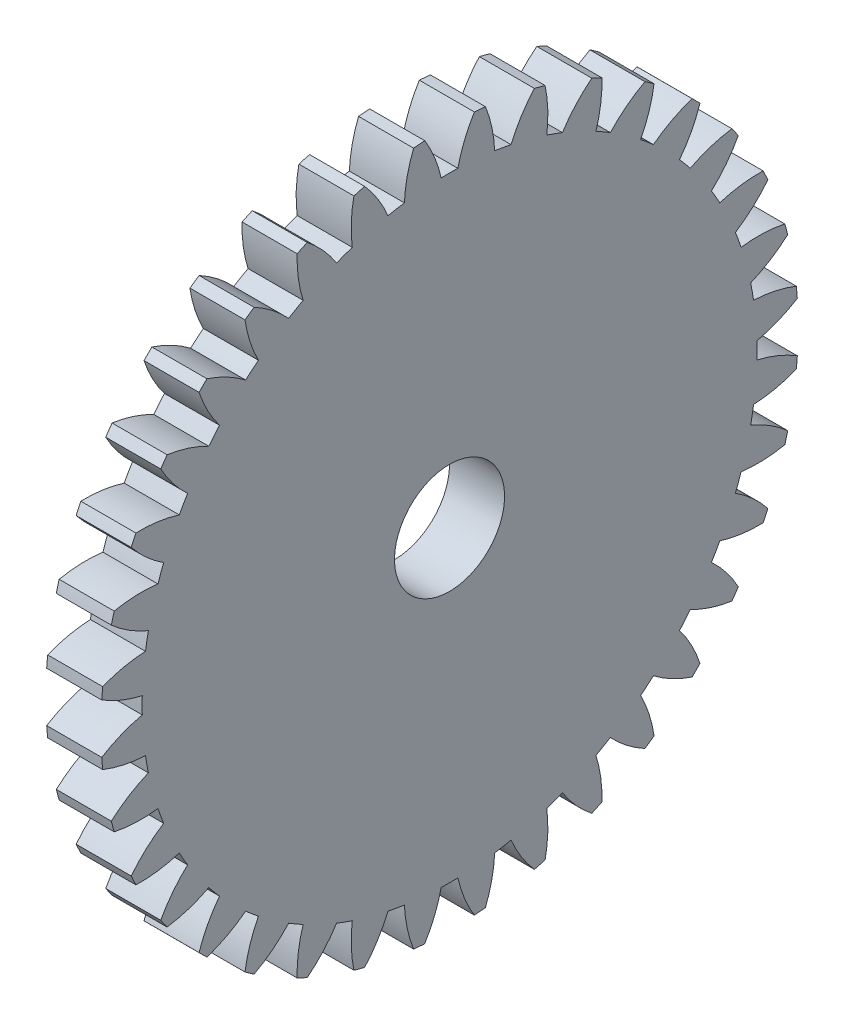
from build123d import *

# Parameters (mm, degrees)
BASPROSKE_W     = 3
BASPROSKE_H     = 19
TOOTHCUT_DEPTH  = 28.037011669
TEETHCUTS_COUNT = 36
TEETHCUTS_ANGLE = 350
BORSKE_R        = 3
BORE_DEPTH      = 50.0000508


with BuildPart() as part:
    # BasProSke → Base-Revolve (revolve)
    with BuildSketch(Plane(origin=(0, 0, 0), x_dir=(1, 0, 0), z_dir=(0, 1, 0)), mode=Mode.PRIVATE) as base_revolve_sk:
        with Locations((1.5, 9.5)):
            Rectangle(BASPROSKE_W, BASPROSKE_H)
    revolve(base_revolve_sk.sketch.rotate(Axis((-10, 0, 0), (1, 0, 0)), 180), axis=Axis((-10, 0, 0), (1, 0, 0)))

    # TooCutSke → ToothCut (cut, through all)
    with BuildSketch(Plane(origin=(0, 0, 0), x_dir=(0, 0, -1), z_dir=(1, 0, 0))):
        with BuildLine():
            ThreePointArc((0.454664826, 16.742827745), (0, 16.749), (-0.454664826, 16.742827745))
            ThreePointArc((-0.454664826, 16.742827745), (-0.817558311, 17.898033097), (-1.368909141, 18.976088452))
            ThreePointArc((-1.368909141, 18.976088452), (0, 19.0254), (1.368909141, 18.976088452))
            ThreePointArc((1.368909141, 18.976088452), (0.817558311, 17.898033097), (0.454664826, 16.742827745))
        make_face()
    toothcut = extrude(amount=TOOTHCUT_DEPTH, mode=Mode.SUBTRACT)

    # TeethCuts: ToothCut ×36 about axis
    teethcuts_axis = Axis((-10, 0, 0), (1, 0, 0))
    for i in range(1, TEETHCUTS_COUNT):
        add(toothcut.rotate(teethcuts_axis, i * TEETHCUTS_ANGLE / (TEETHCUTS_COUNT - 1)), mode=Mode.SUBTRACT)

    # BorSke → Bore (cut, symmetric)
    with BuildSketch(Plane(origin=(0, 0, 0), x_dir=(0, 0, -1), z_dir=(1, 0, 0))):
        with Locations(Location((0, 0, 0), (0, 0, 180))):
            Circle(BORSKE_R)
    extrude(amount=BORE_DEPTH, both=True, mode=Mode.SUBTRACT)


solid = part.part
